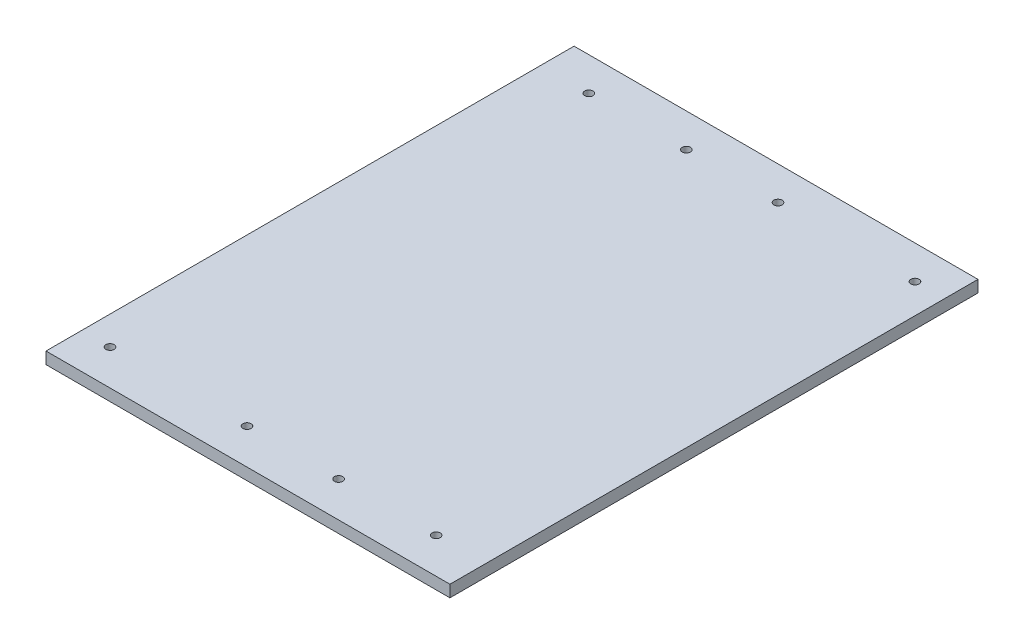
from build123d import *

# Parameters (mm, degrees)
ESBO_O1_W                  = 205
ESBO_O1_H                  = 268
RESSALTO_EXTRUS_O1_DEPTH   = 6
FURO_DE_DI_METRO_4_0_4_1_D = 4.2


with BuildPart() as part:
    # Esboço1 → Ressalto-extrusão1 (new body)
    with BuildSketch(Plane.XZ):
        Rectangle(ESBO_O1_W, ESBO_O1_H)
    extrude(amount=-RESSALTO_EXTRUS_O1_DEPTH)

    # Furo de diâmetro Ø4.0 (4)1 (through all)
    with Locations(Plane(origin=(0, 0, 0), x_dir=(-1, 0, 0), z_dir=(0, -1, 0))):
        with Locations((-87.5, 117), (-18, 117), (-77.5, -116), (-28, -116), (18.5, -116), (88, -116), (28.5, 117), (78, 117)):
            Hole(FURO_DE_DI_METRO_4_0_4_1_D / 2)


solid = part.part
